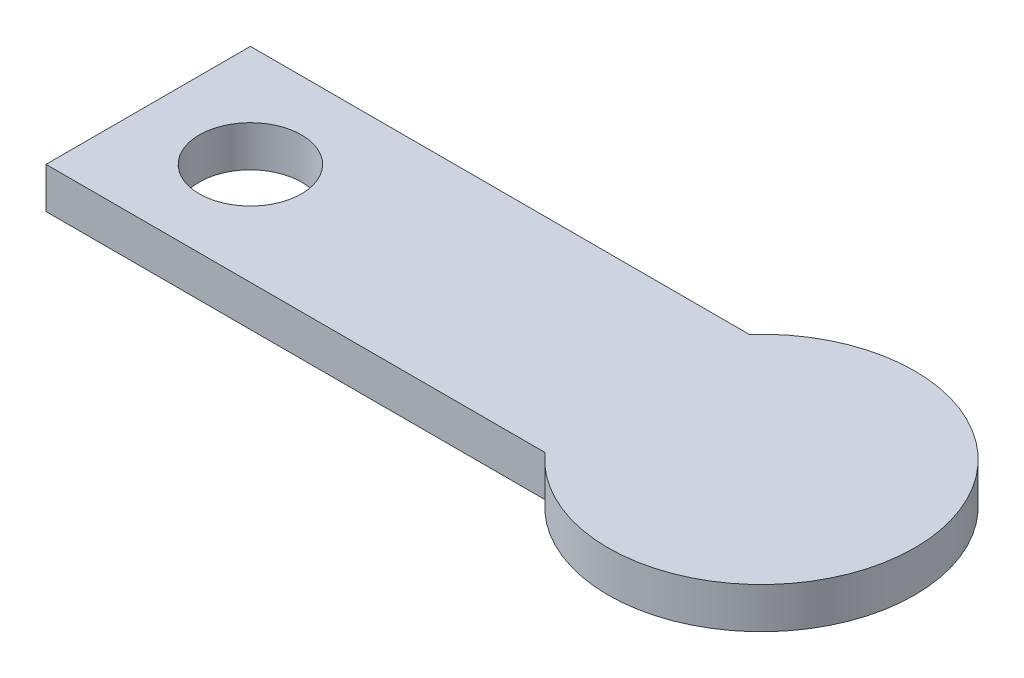
from build123d import *

# Parameters (mm, degrees)
SKETCH1_R           = 3.175
BOSS_EXTRUDE1_DEPTH = 2.54


with BuildPart() as part:
    # Sketch1 → Boss-Extrude1 (new body)
    with BuildSketch(Plane(origin=(0, 0, 0), x_dir=(1, 0, 0), z_dir=(0, 1, 0))):
        with BuildLine():
            Line((-7.099515829, 6.35), (-38.1, 6.35))
            Line((-38.1, 6.35), (-38.1, -6.35))
            Line((-38.1, -6.35), (-7.099515829, -6.35))
            ThreePointArc((-7.099515829, -6.35), (9.525, 0), (-7.099515829, 6.35))
        make_face()
        with Locations((-31.75, 0)):
            Circle(SKETCH1_R, mode=Mode.SUBTRACT)
    extrude(amount=BOSS_EXTRUDE1_DEPTH)


solid = part.part
